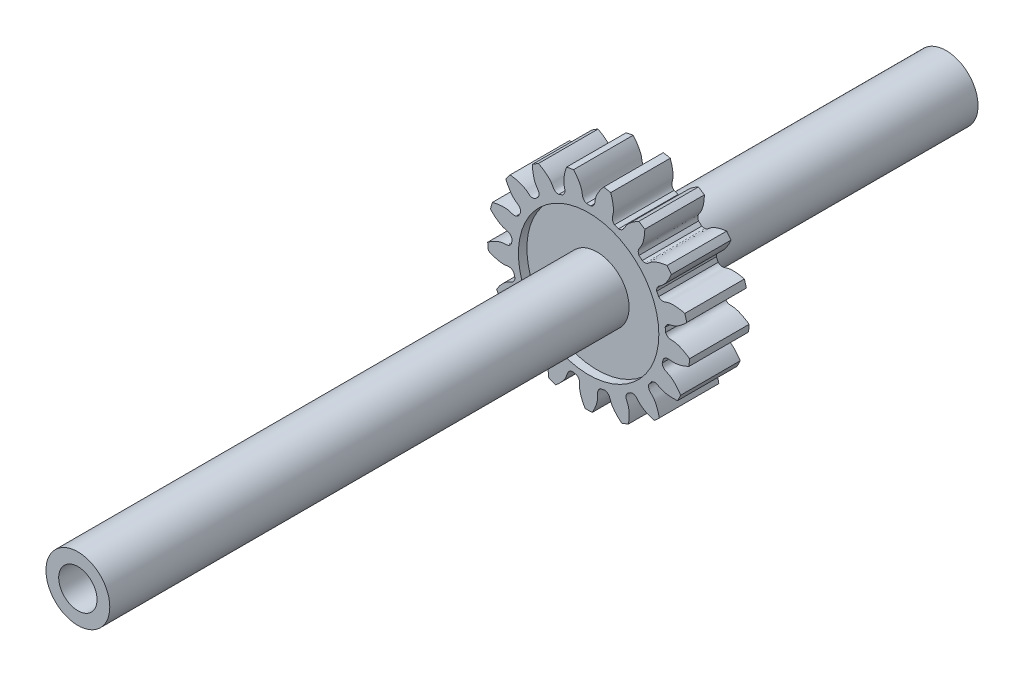
from build123d import *

# Parameters (mm, degrees)
SKETCH_1_R               = 23.75
EXTRUDE_1_DEPTH          = 14
CUT_EXTRUDE_1_DEPTH      = 37.388528412
PATTERN_CIRCULAR_1_COUNT = 17
SKETCH_4_R               = 5
CUT_EXTRUDE_2_DEPTH      = 37.363318476
SKETCH_5_R               = 7.5
SKETCH_5_R_2             = 4.5
EXTRUDE_2_DEPTH          = 120
EXTRUDE_START            = 70
SKETCH_6_R               = 7.5
SKETCH_6_R_2             = 4.5
EXTRUDE_3_DEPTH          = 70
SKETCH_7_R               = 16.5
CUT_EXTRUDE_3_DEPTH      = 2
SKETCH_8_R               = 16.5
CUT_EXTRUDE_4_DEPTH      = 2
SKETCH_12_R              = 7.5
SKETCH_12_R_2            = 4.5
EXTRUDE_7_DEPTH          = 2
SKETCH_13_R              = 5
EXTRUDE_8_DEPTH          = 10
SKETCH_14_R              = 7.5
SKETCH_14_R_2            = 5
EXTRUDE_9_DEPTH          = 2
SKETCH_15_R              = 4.5
CUT_EXTRUDE_9_DEPTH      = 300


with BuildPart() as part:
    # 草图1 → 凸台-拉伸1 (new body)
    with BuildSketch(Plane.XY):
        Circle(SKETCH_1_R)
    extrude(amount=EXTRUDE_1_DEPTH)

    # 草图2 → 切除-拉伸1 (cut, through all)
    with BuildSketch(Plane.XY):
        with BuildLine():
            ThreePointArc((0.504234368, 18.117984786), (0, 18.125), (-0.504234368, 18.117984786))
            add(Edge.make_bspline(
                [(-0.504234368, 18.117984786), (-1.569699351, 18.562055053), (-1.415488445, 19.387033516), (-1.595764011, 20.162060344), (-1.612439336, 20.227876487), (-1.632546256, 20.301048284), (-1.656376475, 20.381463332), (-1.684229444, 20.468998409), (-1.716397699, 20.563521894), (-1.753171113, 20.664893127), (-1.79483528, 20.772962735), (-1.841671697, 20.887572661), (-1.89395741, 21.008556299), (-1.951964818, 21.135738603), (-2.015961439, 21.268936203), (-2.086209687, 21.407957538), (-2.162966654, 21.552602986), (-2.246483889, 21.702664999), (-2.337007189, 21.85792825), (-2.434776387, 22.018169776), (-2.540025144, 22.183159136), (-2.65298075, 22.352658569), (-2.773863923, 22.526423155), (-2.902888613, 22.704200989), (-3.040261815, 22.885733347), (-3.186183381, 23.070754873), (-3.340845837, 23.258993757), (-3.504434208, 23.450171923), (-3.677125843, 23.644005224), (-3.859090249, 23.840203636), (-4.050488925, 24.038471462), (-4.251475208, 24.238507533), (-4.462194114, 24.44000542), (-4.682782197, 24.642653649), (-4.913367398, 24.846135914), (-5.154068914, 25.050131297), (-5.404997061, 25.254314499), (-5.666253152, 25.458356059), (-5.937929372, 25.661922591), (-6.22010866, 25.864677016), (-6.512864618, 26.066278797), (-6.816261336, 26.266384187), (-7.239554087, 26.533576333), (-7.566442255, 26.726314927), (-7.789114583, 26.851797796)],
                knots=[0, 0, 0, 0, 0.193882922, 0.199023975, 0.204850501, 0.211362501, 0.218559975, 0.226442923, 0.235011345, 0.24426524, 0.254204608, 0.264829451, 0.276139767, 0.288135557, 0.300816821, 0.314183558, 0.328235769, 0.342973453, 0.358396612, 0.374505244, 0.39129935, 0.408778929, 0.426943982, 0.445794509, 0.46533051, 0.485551984, 0.506458932, 0.528051354, 0.550329249, 0.573292619, 0.596941461, 0.621275778, 0.646295568, 0.672000832, 0.69839157, 0.725467781, 0.753229466, 0.781676625, 0.810809257, 0.840627364, 0.871130943, 0.902319997, 0.934194524, 1, 1, 1, 1], degree=3))
            ThreePointArc((-7.789114583, 26.851797796), (0, 27.958707961), (7.789114583, 26.851797796))
            add(Edge.make_bspline(
                [(0.504234368, 18.117984786), (1.569699351, 18.562055053), (1.415488445, 19.387033516), (1.595764011, 20.162060344), (1.612439336, 20.227876487), (1.632546256, 20.301048284), (1.656376475, 20.381463332), (1.684229444, 20.468998409), (1.716397699, 20.563521894), (1.753171113, 20.664893127), (1.79483528, 20.772962735), (1.841671697, 20.887572661), (1.89395741, 21.008556299), (1.951964818, 21.135738603), (2.015961439, 21.268936203), (2.086209687, 21.407957538), (2.162966654, 21.552602986), (2.246483889, 21.702664999), (2.337007189, 21.85792825), (2.434776387, 22.018169776), (2.540025144, 22.183159136), (2.65298075, 22.352658569), (2.773863923, 22.526423155), (2.902888613, 22.704200989), (3.040261815, 22.885733347), (3.186183381, 23.070754873), (3.340845837, 23.258993757), (3.504434208, 23.450171923), (3.677125843, 23.644005224), (3.859090249, 23.840203636), (4.050488925, 24.038471462), (4.251475208, 24.238507533), (4.462194114, 24.44000542), (4.682782197, 24.642653649), (4.913367398, 24.846135914), (5.154068914, 25.050131297), (5.404997061, 25.254314499), (5.666253152, 25.458356059), (5.937929372, 25.661922591), (6.22010866, 25.864677016), (6.512864618, 26.066278797), (6.816261336, 26.266384187), (7.239554087, 26.533576333), (7.566442255, 26.726314927), (7.789114583, 26.851797796)],
                knots=[0, 0, 0, 0, 0.193882922, 0.199023975, 0.204850501, 0.211362501, 0.218559975, 0.226442923, 0.235011345, 0.24426524, 0.254204608, 0.264829451, 0.276139767, 0.288135557, 0.300816821, 0.314183558, 0.328235769, 0.342973453, 0.358396612, 0.374505244, 0.39129935, 0.408778929, 0.426943982, 0.445794509, 0.46533051, 0.485551984, 0.506458932, 0.528051354, 0.550329249, 0.573292619, 0.596941461, 0.621275778, 0.646295568, 0.672000832, 0.69839157, 0.725467781, 0.753229466, 0.781676625, 0.810809257, 0.840627364, 0.871130943, 0.902319997, 0.934194524, 1, 1, 1, 1], degree=3))
        make_face()
    cut_extrude_1 = extrude(amount=CUT_EXTRUDE_1_DEPTH, mode=Mode.SUBTRACT)

    # 阵列(圆周)1: 切除-拉伸1 ×17 about axis
    pattern_circular_1_axis = Axis((0, 0, 14), (0, 0, -1))
    for i in range(1, PATTERN_CIRCULAR_1_COUNT):
        add(cut_extrude_1.rotate(pattern_circular_1_axis, i * 360 / PATTERN_CIRCULAR_1_COUNT), mode=Mode.SUBTRACT)

    # 草图4 → 切除-拉伸2 (cut, through all)
    with BuildSketch(Plane.XY.offset(14)):
        Circle(SKETCH_4_R)
    extrude(amount=-CUT_EXTRUDE_2_DEPTH, mode=Mode.SUBTRACT)

    # 草图5 → 凸台-拉伸2 (add)
    with BuildSketch(Plane.XY.offset(14)):
        Circle(SKETCH_5_R)
        Circle(SKETCH_5_R_2, mode=Mode.SUBTRACT)
    extrude(amount=EXTRUDE_2_DEPTH)

    # 草图6 → 凸台-拉伸3 (add)
    with BuildSketch(Plane(origin=(0, 0, 0), x_dir=(-1, 0, 0), z_dir=(0, 0, -1)).offset(EXTRUDE_START)):
        with Locations(Location((0, 0, 0), (0, 0, 180))):
            Circle(SKETCH_6_R)
        with Locations(Location((0, 0, 0), (0, 0, 180))):
            Circle(SKETCH_6_R_2, mode=Mode.SUBTRACT)
    extrude(amount=-EXTRUDE_3_DEPTH)

    # 草图7 → 切除-拉伸3 (cut)
    with BuildSketch(Plane(origin=(0, 0, 0), x_dir=(-1, 0, 0), z_dir=(0, 0, -1))):
        Circle(SKETCH_7_R)
    extrude(amount=-CUT_EXTRUDE_3_DEPTH, mode=Mode.SUBTRACT)


with BuildPart() as cut_extrude_3_piece_1:
    # of the separate pieces the step leaves, piece 1, a body of its own (cut_extrude_3_pieces)
    add(part.part.solids().sort_by_distance((-3.536313643, 23.485250389, 0))[0])

    # 草图8 → 切除-拉伸4 (cut)
    with BuildSketch(Plane.XY.offset(14)):
        with Locations(Location((0, 0, 0), (0, 0, 180))):
            Circle(SKETCH_8_R)
    extrude(amount=-CUT_EXTRUDE_4_DEPTH, mode=Mode.SUBTRACT)


with BuildPart() as cut_extrude_3_piece_2:
    # of the separate pieces the step leaves, piece 2, a body of its own (cut_extrude_3_pieces)
    add(part.part.solids().sort_by_distance((7.5, 0, -70))[0])



with BuildPart() as cut_extrude_4_piece_1:
    # of the separate pieces the step leaves, piece 1, a body of its own (cut_extrude_4_pieces)
    add(cut_extrude_3_piece_1.part.solids().sort_by_distance((-3.536313643, 23.485250389, 0))[0])


with BuildPart() as cut_extrude_4_piece_2:
    # of the separate pieces the step leaves, piece 2, a body of its own (cut_extrude_4_pieces)
    add(cut_extrude_3_piece_1.part.solids().sort_by_distance((7.5, 0, 14))[0])


with BuildPart() as cut_extrude_3_piece_2_1:
    add(cut_extrude_3_piece_2.part)

    add(cut_extrude_4_piece_1.part)  # 凸台-拉伸7 merges 切除-拉伸4 piece 1
    # 草图12 → 凸台-拉伸7 (add)
    with BuildSketch(Plane(origin=(0, 0, 2), x_dir=(-1, 0, 0), z_dir=(0, 0, -1))):
        with Locations(Location((0, 0, 0), (0, 0, 180))):
            Circle(SKETCH_12_R)
        with Locations(Location((0, 0, 0), (0, 0, 180))):
            Circle(SKETCH_12_R_2, mode=Mode.SUBTRACT)
    extrude(amount=EXTRUDE_7_DEPTH)

    # 草图13 → 凸台-拉伸8 (add)
    with BuildSketch(Plane.XY.offset(12)):
        Circle(SKETCH_13_R)
    extrude(amount=-EXTRUDE_8_DEPTH)


    add(cut_extrude_4_piece_2.part)  # 凸台-拉伸9 merges 切除-拉伸4 piece 2
    # 草图14 → 凸台-拉伸9 (add)
    with BuildSketch(Plane.XY.offset(12)):
        Circle(SKETCH_14_R)
        Circle(SKETCH_14_R_2, mode=Mode.SUBTRACT)
    extrude(amount=EXTRUDE_9_DEPTH)

    # 草图15 → 切除-拉伸9 (cut)
    with BuildSketch(Plane.XY.offset(134)):
        Circle(SKETCH_15_R)
    extrude(amount=-CUT_EXTRUDE_9_DEPTH, mode=Mode.SUBTRACT)


solid = cut_extrude_3_piece_2_1.part
